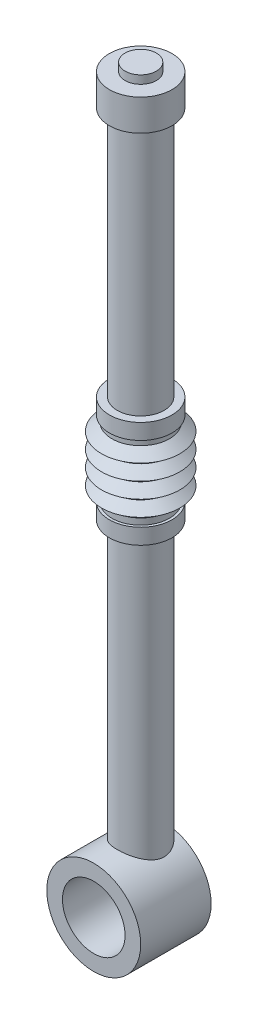
from build123d import *

# Parameters (mm, degrees)
BOSS_EXTRUDE1_DEPTH                  = 4.7625
BOSS_EXTRUDE1_DEPTH_BACK             = 2.38125
SKETCH1_R                            = 4.7625
SKETCH1_R_2                          = 3.175
SKETCH2_R                            = 2.38125
BOSS_EXTRUDE2_DEPTH                  = 28.575
BOSS_EXTRUDE2_DIRECTION_2_REACH      = 13.666
BOSS_EXTRUDE2_DIRECTION_2_END_RADIUS = 4.7625
SKETCH3_W                            = 3.175
SKETCH3_H                            = 1.5875
BOSS_EXTRUDE3_START                  = 25.4
SKETCH4_R                            = 2.38125
BOSS_EXTRUDE3_DEPTH                  = 25.4
SKETCH5_R                            = 3.175
BOSS_EXTRUDE4_DEPTH                  = 3.175
SKETCH6_R                            = 1.5875
BOSS_EXTRUDE5_DEPTH                  = 0.83185


with BuildPart() as part:
    # Sketch1 → Boss-Extrude1 (new, two sides: drawn at the far end of the back side and taken through both)
    with BuildSketch(Plane.XY.offset(-BOSS_EXTRUDE1_DEPTH_BACK)):
        Circle(SKETCH1_R)
        Circle(SKETCH1_R_2, mode=Mode.SUBTRACT)
    extrude(amount=BOSS_EXTRUDE1_DEPTH + BOSS_EXTRUDE1_DEPTH_BACK)

    # Sketch2 → Boss-Extrude2 (add)
    with BuildSketch(Plane(origin=(0, 4.7625, 0), x_dir=(1, 0, 0), z_dir=(0, 1, 0))):
        with Locations(Location((0, 0, 0), (0, 0, 90.000000028))):
            Circle(SKETCH2_R)
    extrude(amount=BOSS_EXTRUDE2_DEPTH)

    # Boss-Extrude2 direction 2: up to this cylinder (the profile starts outside it)
    boss_extrude2_direction_2_end = Plane(origin=(0, 0, 0), z_dir=(0, 0, 1)) * Cylinder(BOSS_EXTRUDE2_DIRECTION_2_END_RADIUS, 37.857, mode=Mode.PRIVATE)
    # Sketch2 → Boss-Extrude2 direction 2 (add, up to the surface)
    with BuildSketch(Plane(origin=(0, 4.7625, 0), x_dir=(1, 0, 0), z_dir=(0, 1, 0)), mode=Mode.PRIVATE) as boss_extrude2_direction_2_sk1:
        with Locations(Location((0, 0, 0), (0, 0, 90.000000028))):
            Circle(SKETCH2_R)
    boss_extrude2_direction_2_tool1 = extrude(boss_extrude2_direction_2_sk1.sketch, amount=-BOSS_EXTRUDE2_DIRECTION_2_REACH, mode=Mode.PRIVATE) - boss_extrude2_direction_2_end
    add(boss_extrude2_direction_2_tool1.solids().sort_by_distance((0, 4.7625, 0))[0])
    add(boss_extrude2_direction_2_tool1.solids().sort_by_distance((0, 4.7625, 0))[1])

    # Sketch3 → Revolve1 (revolve)
    with BuildSketch(Plane(origin=(0, 0, 0), x_dir=(0, 0, -1), z_dir=(1, 0, 0)), mode=Mode.PRIVATE) as revolve1_sk:
        with Locations((-1.5875, 33.3375)):
            Rectangle(SKETCH3_W, SKETCH3_H)
        Polygon((-2.921, 34.76625), (-2.921, 34.13125), (0, 34.13125), (0, 43.33875), (-3.175, 43.33875), (-3.175, 41.75125), (-2.921, 41.75125), (-2.921, 41.11625), (-3.96875, 40.3225), (-2.921, 39.52875), (-3.96875, 38.735), (-2.921, 37.94125), (-3.96875, 37.1475), (-2.921, 36.35375), (-3.96875, 35.56), align=None)
    revolve(revolve1_sk.sketch.rotate(Axis((0, 32.54375, 0), (0, 1, 0)), 180), axis=Axis((0, 32.54375, 0), (0, 1, 0)))

    # Sketch4 → Boss-Extrude3 (add)
    with BuildSketch(Plane(origin=(0, 43.33875, 0), x_dir=(1, 0, 0), z_dir=(0, 1, 0)).offset(BOSS_EXTRUDE3_START)):
        with Locations(Location((0, 0, 0), (0, 0, 90))):
            Circle(SKETCH4_R)
    extrude(amount=-BOSS_EXTRUDE3_DEPTH)

    # Sketch5 → Boss-Extrude4 (add)
    with BuildSketch(Plane(origin=(0, 68.73875, 0), x_dir=(1, 0, 0), z_dir=(0, 1, 0))):
        with Locations(Location((0, 0, 0), (0, 0, 90))):
            Circle(SKETCH5_R)
    extrude(amount=BOSS_EXTRUDE4_DEPTH)

    # Sketch6 → Boss-Extrude5 (add)
    with BuildSketch(Plane(origin=(0, 71.91375, 0), x_dir=(1, 0, 0), z_dir=(0, 1, 0))):
        with Locations(Location((0, 0, 0), (0, 0, 270))):
            Circle(SKETCH6_R)
    extrude(amount=BOSS_EXTRUDE5_DEPTH)


solid = part.part
